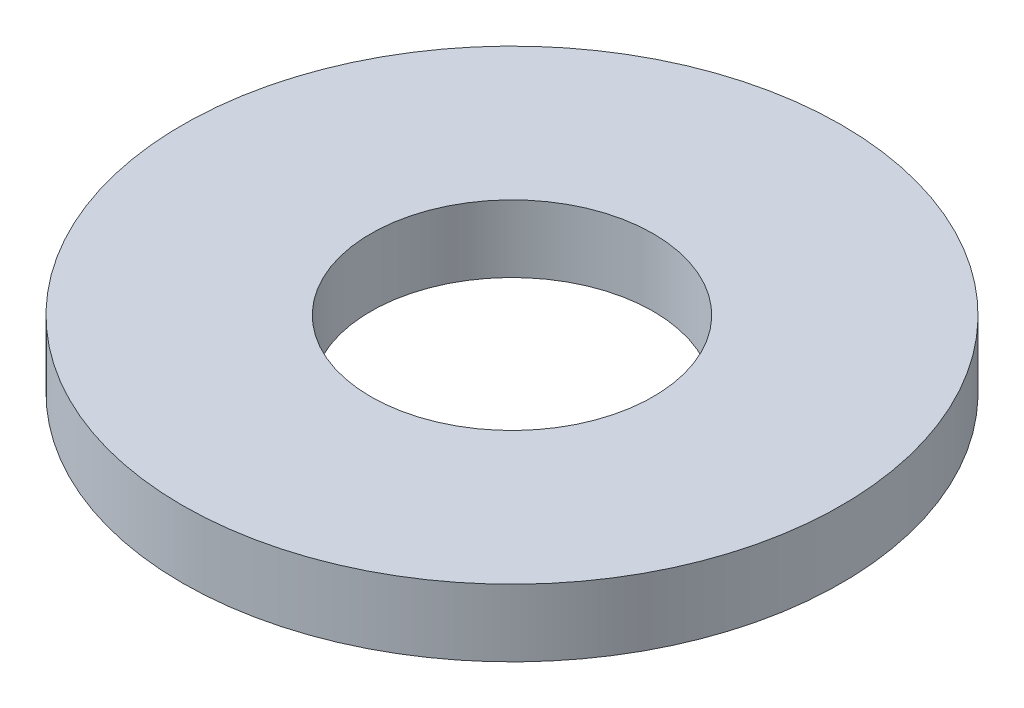
from build123d import *

# Parameters (mm, degrees)
SKETCH1_R           = 2.45
SKETCH1_R_2         = 1.05
BOSS_EXTRUDE1_DEPTH = 0.5


with BuildPart() as part:
    # Sketch1 → Boss-Extrude1 (new body)
    with BuildSketch(Plane(origin=(0, 0, 0), x_dir=(1, 0, 0), z_dir=(0, 1, 0))):
        with Locations(Location((0, 0, 0), (0, 0, 270))):
            Circle(SKETCH1_R)
        with Locations(Location((0, 0, 0), (0, 0, 270))):
            Circle(SKETCH1_R_2, mode=Mode.SUBTRACT)
    extrude(amount=BOSS_EXTRUDE1_DEPTH)


solid = part.part
